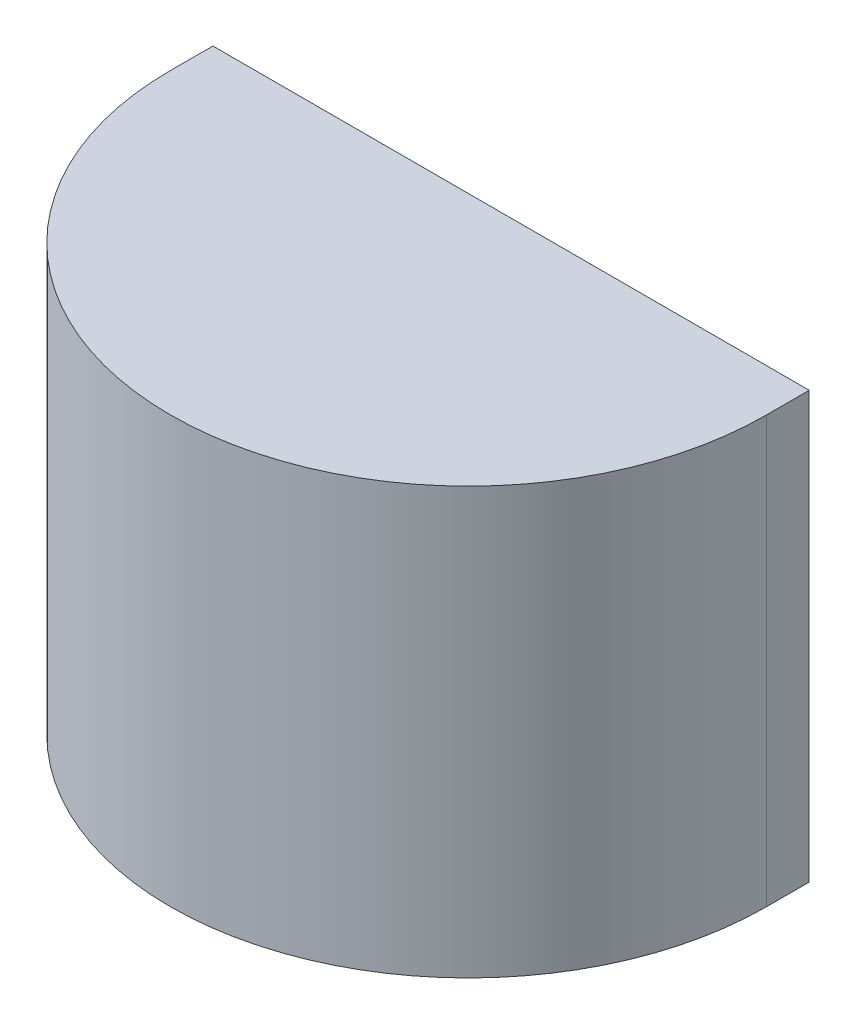
from build123d import *

# Parameters (mm, degrees)
SKETCH1_W           = 88.9
SKETCH1_H           = 25.4
SKETCH1_R           = 4.3561
BOSS_EXTRUDE1_DEPTH = 6.35
SKETCH2_W           = 88.9
SKETCH2_H           = 6.35
BOSS_EXTRUDE2_DEPTH = 6.35
BOSS_EXTRUDE3_START = -63.5
BOSS_EXTRUDE3_DEPTH = 63.5


with BuildPart() as part:
    # Sketch1 → Boss-Extrude1 (new body)
    with BuildSketch(Plane.XY):
        Rectangle(SKETCH1_W, SKETCH1_H)
        with Locations((-31.75, 0)):
            Circle(SKETCH1_R, mode=Mode.SUBTRACT)
        with Locations((31.75, 0)):
            Circle(SKETCH1_R, mode=Mode.SUBTRACT)
    extrude(amount=BOSS_EXTRUDE1_DEPTH)

    # Sketch2 → Boss-Extrude2 (add)
    with BuildSketch(Plane(origin=(0, 12.7, 0), x_dir=(1, 0, 0), z_dir=(0, 1, 0))):
        with Locations((0, -3.175)):
            Rectangle(SKETCH2_W, SKETCH2_H)
        with BuildLine():
            ThreePointArc((-44.45, -6.35), (0, -50.8), (44.45, -6.35))
            Line((44.45, -6.35), (-44.45, -6.35))
        make_face()
    extrude(amount=BOSS_EXTRUDE2_DEPTH)

    # Sketch3 → Boss-Extrude3 (add)
    with BuildSketch(Plane(origin=(0, 19.05, 0), x_dir=(1, 0, 0), z_dir=(0, 1, 0)).offset(BOSS_EXTRUDE3_START)):
        with BuildLine():
            ThreePointArc((-44.45, -6.35), (0, -50.8), (44.45, -6.35))
            Line((44.45, -6.35), (44.45, 0))
            Line((44.45, 0), (38.1, 0))
            Line((38.1, 0), (38.1, -6.35))
            ThreePointArc((38.1, -6.35), (0, -44.45), (-38.1, -6.35))
            Line((-38.1, -6.35), (-38.1, 0))
            Line((-38.1, 0), (-44.45, 0))
            Line((-44.45, 0), (-44.45, -6.35))
        make_face()
    extrude(amount=BOSS_EXTRUDE3_DEPTH)


solid = part.part
